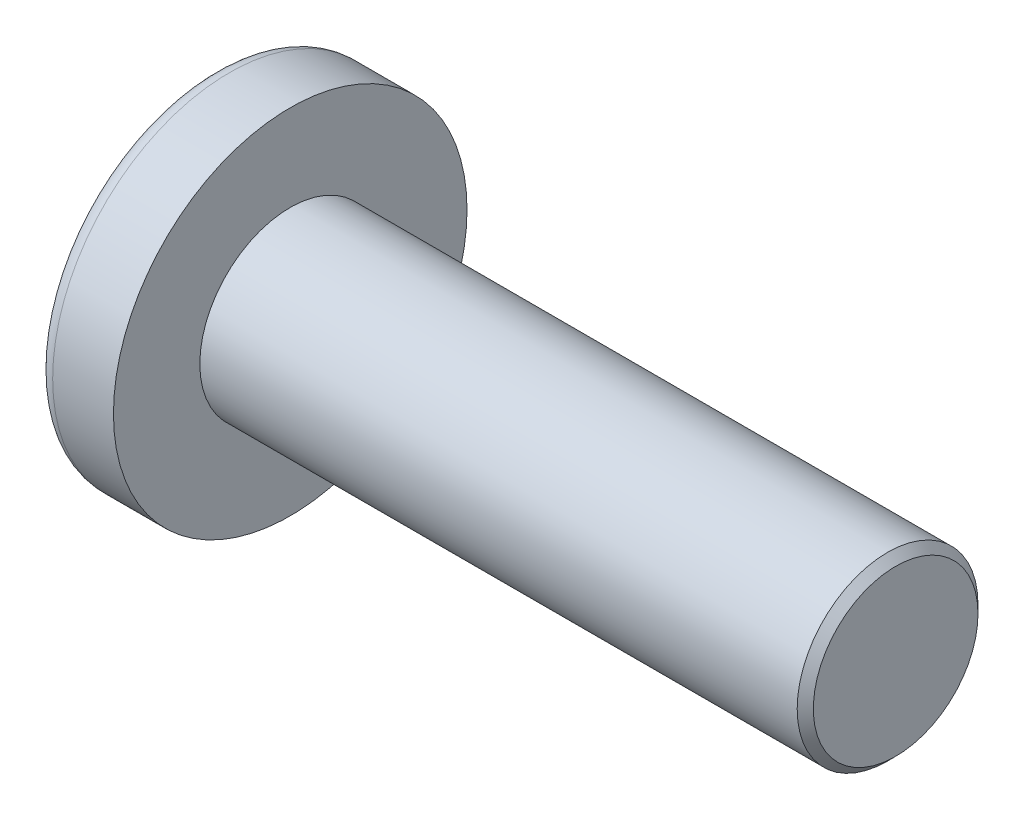
from build123d import *

# Parameters (mm, degrees)
CIRPATTERN1_COUNT = 2
CIRPATTERN1_ANGLE = 90
CHAMFER1_SIZE     = 0.127


with BuildPart() as part:
    # BodySke → Base-Revolve (revolve)
    with BuildSketch(Plane.XY, mode=Mode.PRIVATE) as base_revolve_sk:
        with BuildLine():
            Line((2.032, 1.4224), (2.032, 2.7813))
            Line((2.032, 2.7813), (1.075646615, 2.7813))
            ThreePointArc((1.075646615, 2.7813), (0.960371669, 2.753635341), (0.87020729, 2.676667612))
            ThreePointArc((0.87020729, 2.676667612), (0.223015279, 1.407285528), (0, 0))
            Line((0, 0), (11.557, 0))
            Line((11.557, 0), (11.557, 1.4224))
            Line((11.557, 1.4224), (2.032, 1.4224))
        make_face()
    revolve(base_revolve_sk.sketch.rotate(Axis((-25.4, 0, 0), (1, 0, 0)), 90), axis=Axis((-25.4, 0, 0), (1, 0, 0)))

    # Sketch3 → Cut-Loft1 section 0
    with BuildSketch(Plane(origin=(0, 0, 0), x_dir=(0, 0, -1), z_dir=(1, 0, 0))):
        with BuildLine():
            Line((0.4064, -1.8161), (-0.4064, -1.8161))
            Line((-0.4064, -1.8161), (-0.4064, 1.8161))
            Line((-0.4064, 1.8161), (0.4064, 1.8161))
            Line((0.4064, 1.8161), (0.4064, -1.8161))
        make_face()
    # Sketch4 → Cut-Loft1 section 1
    with BuildSketch(Plane(origin=(2.0066, 0, 0), x_dir=(0, 0, -1), z_dir=(1, 0, 0))):
        with BuildLine():
            Line((0.2032, -0.2032), (-0.2032, -0.2032))
            Line((-0.2032, -0.2032), (-0.2032, 0.2032))
            Line((-0.2032, 0.2032), (0.2032, 0.2032))
            Line((0.2032, 0.2032), (0.2032, -0.2032))
        make_face()
    cut_loft1 = loft(mode=Mode.SUBTRACT)

    # CirPattern1: Cut-Loft1 ×2 about axis
    cirpattern1_axis = Axis((0, 0, 0), (1, 0, 0))
    for i in range(1, CIRPATTERN1_COUNT):
        add(cut_loft1.rotate(cirpattern1_axis, i * CIRPATTERN1_ANGLE / (CIRPATTERN1_COUNT - 1)), mode=Mode.SUBTRACT)

    # Chamfer1
    chamfer1_edges = [part.edges().sort_by_distance(p)[0] for p in [
        (11.557, 0, -1.4224),
    ]]
    chamfer(chamfer1_edges, length=CHAMFER1_SIZE)


solid = part.part
